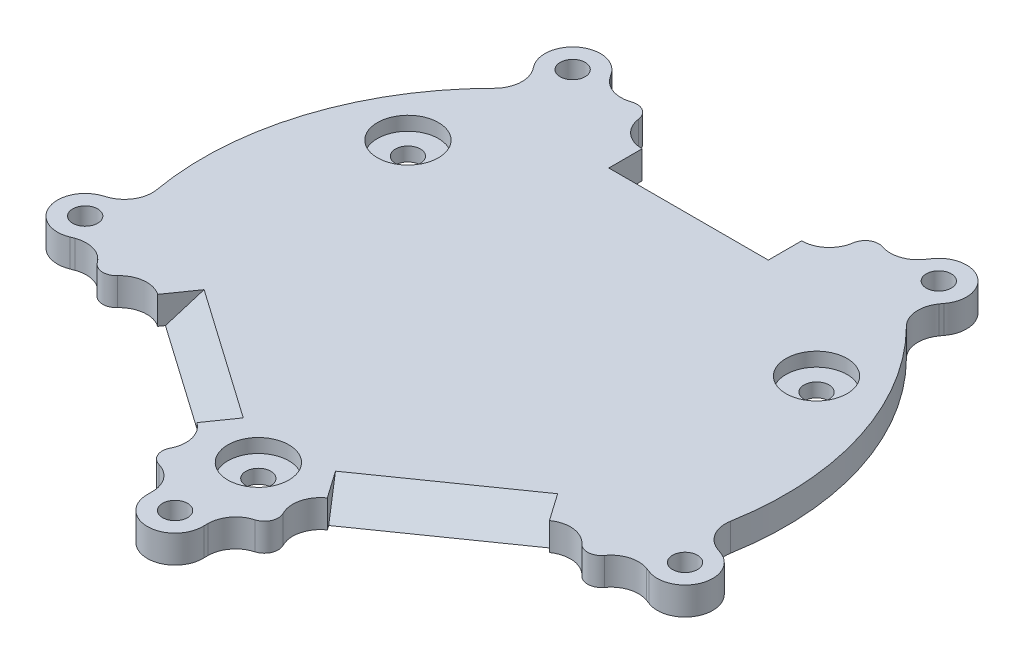
from build123d import *

# Parameters (mm, degrees)
BOSS_EXTRUDE1_DEPTH     = 5
ENL_V_START             = 5
SKETCH1_3_R             = 5.5
ENL_V_MAT_EXTRU_3_DEPTH = 2.5
M4_CLEARANCE_HOLE1_D    = 4.5
CONG_1_R                = 2.5
BOSS_EXTRU_1_START      = -5
BOSS_EXTRU_1_DEPTH      = 5
M4_CLEARANCE_HOLE2_D    = 4.5
CONG_2_R                = 5
ENL_V_MAT_EXTRU_4_DEPTH = 28.73465
ENL_V_MAT_EXTRU_5_DEPTH = 28.73465
ENL_V_MAT_EXTRU_6_DEPTH = 28.734645


with BuildPart() as part:
    # Sketch1 → Boss-Extrude1 (new body)
    with BuildSketch(Plane(origin=(0, 0, 0), x_dir=(1, 0, 0), z_dir=(0, 1, 0))):
        with BuildLine():
            Line((-39.326268345, -22.515208594), (-7.706999436, -44.655259037))
            Line((-7.706999436, -44.655259037), (-12.194526514, -51.06411189))
            ThreePointArc((-12.194526514, -51.06411189), (0, -52.5), (12.194526514, -51.06411189))
            Line((12.194526514, -51.06411189), (7.706999436, -44.655259037))
            Line((7.706999436, -44.655259037), (39.326268345, -22.515208594))
            Line((39.326268345, -22.515208594), (43.813795424, -28.924061447))
            ThreePointArc((43.813795424, -28.924061447), (50.070139914, 15.787054474), (19.3, 48.823764705))
            Line((19.3, 48.823764705), (19.3, 41))
            Line((19.3, 41), (-19.3, 41))
            Line((-19.3, 41), (-19.3, 48.823764705))
            ThreePointArc((-19.3, 48.823764705), (-50.070139914, 15.787054474), (-43.813795424, -28.924061447))
            Line((-43.813795424, -28.924061447), (-39.326268345, -22.515208594))
        make_face()
    extrude(amount=BOSS_EXTRUDE1_DEPTH)

    # Sketch1<3> → Enlèv. mat.-Extru.3 (cut)
    with BuildSketch(Plane(origin=(0, 0, 0), x_dir=(1, 0, 0), z_dir=(0, 1, 0)).offset(ENL_V_START)):
        with Locations(Location((-36.806079661, 21.25, 0), (0, 0, 270))):
            Circle(SKETCH1_3_R)
        with Locations(Location((36.806079661, 21.25, 0), (0, 0, 270))):
            Circle(SKETCH1_3_R)
        with Locations(Location((0, -42.5, 0), (0, 0, 270))):
            Circle(SKETCH1_3_R)
    extrude(amount=-ENL_V_MAT_EXTRU_3_DEPTH, mode=Mode.SUBTRACT)

    # M4 Clearance Hole1 (through all)
    with Locations(Plane(origin=(0, 5, 0), x_dir=(1, 0, 0), z_dir=(0, 1, 0))):
        with Locations((0, -42.5), (36.806079661, 21.25), (-36.806079661, 21.25)):
            Hole(M4_CLEARANCE_HOLE1_D / 2)

    # Congé1
    cong_1_edges = [part.edges().sort_by_distance(p)[0] for p in [
        (-43.813795424, 2.5, 28.924061447),
        (-19.3, 2.5, -48.823764705),
        (19.3, 2.5, -48.823764705),
        (43.813795424, 2.5, 28.924061447),
        (12.194526514, 2.5, 51.06411189),
        (-12.194526514, 2.5, 51.06411189),
    ]]
    fillet(cong_1_edges, radius=CONG_1_R)

    # Esquisse5 → Boss.-Extru.1 (add)
    with BuildSketch(Plane(origin=(0, 5, 0), x_dir=(1, 0, 0), z_dir=(0, 1, 0)).offset(BOSS_EXTRU_1_START)):
        with BuildLine():
            Line((-52.119561091, -24.285826148), (-47.401557872, -22.568613411))
            ThreePointArc((-47.401557872, -22.568613411), (-49.333862591, -17.956057525), (-50.818525072, -13.180573187))
            Line((-50.818525072, -13.180573187), (-55.53652829, -14.897785924))
            ThreePointArc((-55.53652829, -14.897785924), (-58.730788799, -21.376258958), (-52.119561091, -24.285826148))
        make_face()
        with BuildLine():
            Line((-36.947841722, 44.057995779), (-34.068032502, 39.945201983))
            ThreePointArc((-34.068032502, 39.945201983), (-30.112762908, 43.005482325), (-25.88425818, 45.675542454))
            Line((-25.88425818, 45.675542454), (-28.764067399, 49.788336251))
            ThreePointArc((-28.764067399, 49.788336251), (-35.848527272, 51.197002768), (-36.947841722, 44.057995779))
        make_face()
        with BuildLine():
            Line((36.947841722, 44.057995779), (34.068032502, 39.945201983))
            ThreePointArc((34.068032502, 39.945201983), (30.112762908, 43.005482325), (25.88425818, 45.675542454))
            Line((25.88425818, 45.675542454), (28.764067399, 49.788336251))
            ThreePointArc((28.764067399, 49.788336251), (35.848527272, 51.197002768), (36.947841722, 44.057995779))
        make_face()
        with BuildLine():
            Line((52.119561091, -24.285826148), (47.401557872, -22.568613411))
            ThreePointArc((47.401557872, -22.568613411), (49.333862591, -17.956057525), (50.818525072, -13.180573187))
            Line((50.818525072, -13.180573187), (55.53652829, -14.897785924))
            ThreePointArc((55.53652829, -14.897785924), (58.730788799, -21.376258958), (52.119561091, -24.285826148))
        make_face()
        with BuildLine():
            Line((4.995271867, -57.282608696), (4.995271867, -52.26181454))
            ThreePointArc((4.995271867, -52.26181454), (0, -52.5), (-4.995271867, -52.26181454))
            Line((-4.995271867, -52.26181454), (-4.995271867, -57.282608696))
            ThreePointArc((-4.995271867, -57.282608696), (0, -62.5), (4.995271867, -57.282608696))
        make_face()
    extrude(amount=BOSS_EXTRU_1_DEPTH)

    # M4 Clearance Hole2 (through all)
    with Locations(Plane(origin=(0, 5, 0), x_dir=(1, 0, 0), z_dir=(0, 1, 0))):
        with Locations((0, -57.5), (54.032325695, -19.666158241), (32.98064509, 47.101242547), (-32.98064509, 47.101242547), (-54.032325695, -19.666158241)):
            Hole(M4_CLEARANCE_HOLE2_D / 2)

    # Congé2
    cong_2_edges = [part.edges().sort_by_distance(p)[0] for p in [
        (47.401557872, 2.5, 22.568613411),
        (50.818525072, 2.5, 13.180573187),
        (34.068032502, 2.5, -39.945201983),
        (-34.068032502, 2.5, -39.945201983),
        (-50.818525072, 2.5, 13.180573187),
        (-47.401557872, 2.5, 22.568613411),
        (4.995271867, 2.5, 52.26181454),
        (-4.995271867, 2.5, 52.26181454),
        (25.88425818, 2.5, -45.675542454),
        (-25.88425818, 2.5, -45.675542454),
        (-7.706999436, 2.5, 44.655259037),
        (-39.326268345, 2.5, 22.515208594),
        (-19.3, 2.5, -41),
        (19.3, 2.5, -41),
        (39.326268345, 2.5, 22.515208594),
        (7.706999436, 2.5, 44.655259037),
    ]]
    fillet(cong_2_edges, radius=CONG_2_R)

    # Esquisse9 → Enlèv. mat.-Extru.4 (cut)
    with BuildSketch(Plane(origin=(11.769023549, 0, 8.240759006), x_dir=(0, 1, 0), z_dir=(0.8191520442889952, 0, 0.5735764363510412))):
        Polygon((0, 41), (5, 41), (5, 35), (0, 40), align=None)
    extrude(amount=-ENL_V_MAT_EXTRU_4_DEPTH, mode=Mode.SUBTRACT)

    # Esquisse10 → Enlèv. mat.-Extru.5 (cut)
    with BuildSketch(Plane(origin=(-11.769023549, 0, 8.240759006), x_dir=(0, -1, 0), z_dir=(-0.8191520442889948, 0, 0.5735764363510419))):
        Polygon((-5, 41), (-5, 35), (0, 40), (0, 41), align=None)
    extrude(amount=-ENL_V_MAT_EXTRU_5_DEPTH, mode=Mode.SUBTRACT)

    # Esquisse11 → Enlèv. mat.-Extru.6 (cut)
    with BuildSketch(Plane(origin=(-14.367324883, 0, 0), x_dir=(0, 1, 0), z_dir=(-1, 0, 0))):
        Polygon((0, 41), (5, 41), (5, 35), (0, 40), align=None)
    extrude(amount=-ENL_V_MAT_EXTRU_6_DEPTH, mode=Mode.SUBTRACT)


solid = part.part
